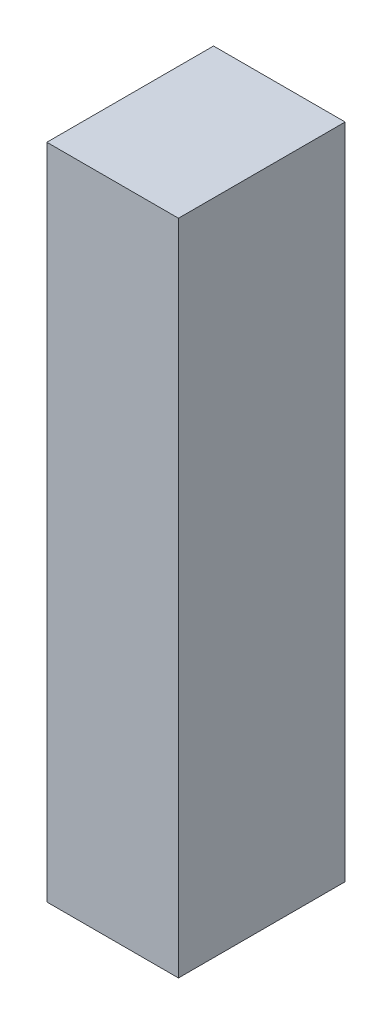
from build123d import *

# Parameters (mm, degrees)
SKETCH1_W           = 15
SKETCH1_H           = 19
BOSS_EXTRUDE1_DEPTH = 75


with BuildPart() as part:
    # Sketch1 → Boss-Extrude1 (new body)
    with BuildSketch(Plane(origin=(0, 0, 0), x_dir=(1, 0, 0), z_dir=(0, 1, 0))):
        Rectangle(SKETCH1_W, SKETCH1_H)
    extrude(amount=BOSS_EXTRUDE1_DEPTH)


solid = part.part
